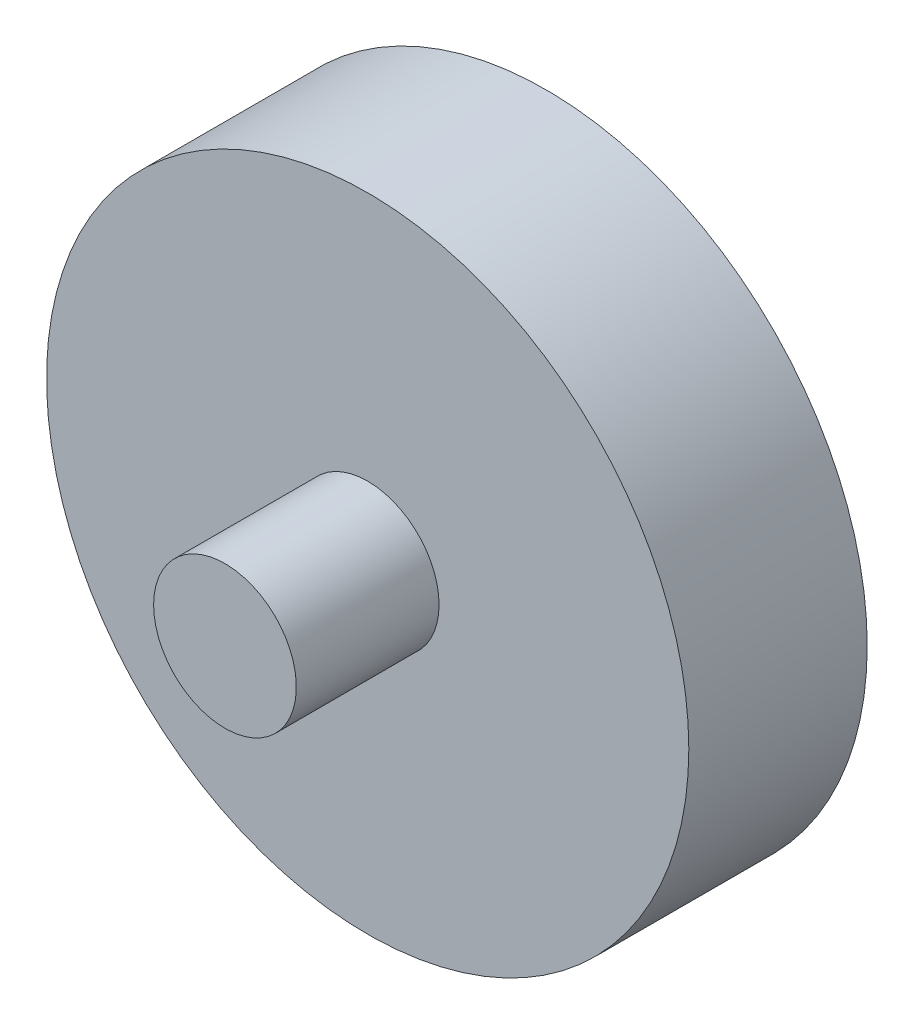
from build123d import *

# Parameters (mm, degrees)
SKETCH1_R          = 11.43
MAIN_BODY_DEPTH    = 6.35
NIBBLES_DEPTH      = 5.08
NIBBLES_DEPTH_BACK = 11.43
SKETCH13_R         = 2.54


with BuildPart() as part:
    # Sketch1 → main body (new body)
    with BuildSketch(Plane.XY):
        Circle(SKETCH1_R)
    extrude(amount=MAIN_BODY_DEPTH)

    # Sketch13 → nibbles (add, two sides: drawn at the far end of the back side and taken through both)
    with BuildSketch(Plane(origin=(0, 0, 0), x_dir=(-1, 0, 0), z_dir=(0, 0, -1)).offset(-NIBBLES_DEPTH_BACK)):
        Circle(SKETCH13_R)
    extrude(amount=NIBBLES_DEPTH + NIBBLES_DEPTH_BACK)


solid = part.part
